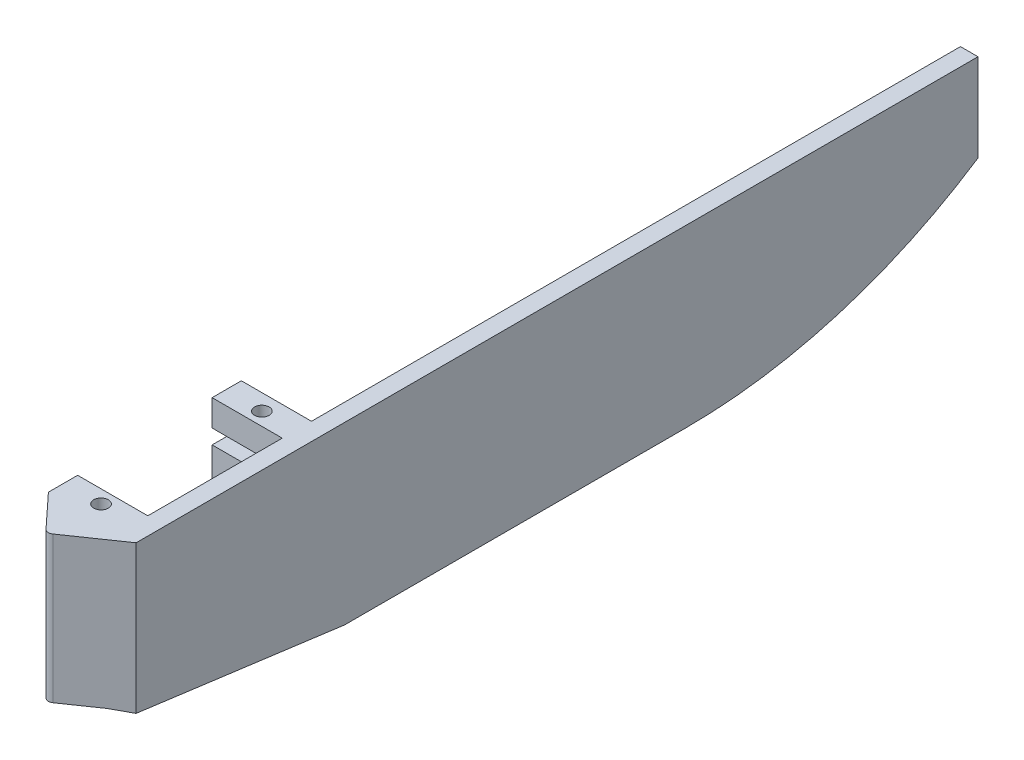
from build123d import *

# Parameters (mm, degrees)
SKETCH_1_W          = 150
SKETCH_1_H          = 30
EXTRUDE_1_DEPTH     = 3
SKETCH_2_W          = 5
SKETCH_2_H          = 4.5
SKETCH_2_H_2        = 5
EXTRUDE_2_DEPTH     = 12
SKETCH_3_R          = 1.25
CUT_EXTRUDE_1_DEPTH = 12
CUT_EXTRUDE_2_DEPTH = 33
SKETCH_6_W          = 12
SKETCH_6_H          = 5
CUT_EXTRUDE_3_DEPTH = 14
CUT_EXTRUDE_4_DEPTH = 14
CUT_EXTRUDE_5_DEPTH = 14
SKETCH_9_W          = 52.537386277
SKETCH_9_H          = 169.005460475
CUT_EXTRUDE_6_DEPTH = 39


with BuildPart() as part:
    # 草图1 → 凸台-拉伸1 (new body)
    with BuildSketch(Plane(origin=(0, 0, 0), x_dir=(0, 0, -1), z_dir=(1, 0, 0))):
        with Locations((75, 15)):
            Rectangle(SKETCH_1_W, SKETCH_1_H)
    extrude_1 = extrude(amount=EXTRUDE_1_DEPTH)

    # 草图2 → 凸台-拉伸2 (add)
    with BuildSketch(Plane(origin=(3, 0, 0), x_dir=(0, 0, -1), z_dir=(1, 0, 0))):
        Polygon((6, 30), (11, 30), (11, 25.500001474), (6.003642258, 25.500001474), (6.003642258, 23.000001474), (11.003642258, 23.000001474), (11.003642258, 18.000001474), (6.003642258, 18.000001474), (6.003642258, 0), (0, 0), (0, 30), align=None)
        with Locations((36.5, 27.75)):
            Rectangle(SKETCH_2_W, SKETCH_2_H)
        with Locations((36.503642258, 20.500001474)):
            Rectangle(SKETCH_2_W, SKETCH_2_H_2)
    extrude_2 = extrude(amount=EXTRUDE_2_DEPTH)

    # 草图3 → 切除-拉伸1 (cut)
    with BuildSketch(Plane(origin=(0, 30, 0), x_dir=(1, 0, 0), z_dir=(0, 1, 0))):
        with Locations(Location((8.75, 36.25, 0), (0, 0, 270))):
            Circle(SKETCH_3_R)
        with Locations(Location((8.75, 8.75, 0), (0, 0, 270))):
            Circle(SKETCH_3_R)
    cut_extrude_1 = extrude(amount=-CUT_EXTRUDE_1_DEPTH, mode=Mode.SUBTRACT)

    # 草图5 → 切除-拉伸2 (cut)
    with BuildSketch(Plane(origin=(0, 30, 0), x_dir=(1, 0, 0), z_dir=(0, 1, 0))):
        with BuildLine():
            Line((0, 0), (9, 0))
            ThreePointArc((9, 0), (8.702388097, 0.045313059), (8.431747605, 0.17714569))
            Line((8.431747605, 0.17714569), (0, 6))
            Line((0, 6), (0, 0))
        make_face()
        with BuildLine():
            Line((15, 0), (15, 6))
            Line((15, 6), (9.733275958, 0.32006885))
            ThreePointArc((9.733275958, 0.32006885), (9.400043029, 0.083503642), (9, 0))
            Line((9, 0), (15, 0))
        make_face()
    cut_extrude_2 = extrude(amount=-CUT_EXTRUDE_2_DEPTH, mode=Mode.SUBTRACT)

    # 草图6 → 切除-拉伸3 (cut)
    with BuildSketch(Plane(origin=(0, 0, -6.003642258), x_dir=(-1, 0, 0), z_dir=(0, 0, -1))):
        with Locations((-9, 2.5)):
            Rectangle(SKETCH_6_W, SKETCH_6_H)
    cut_extrude_3 = extrude(amount=-CUT_EXTRUDE_3_DEPTH, mode=Mode.SUBTRACT)

    # 草图7 → 切除-拉伸4 (cut)
    with BuildSketch(Plane(origin=(3, 0, 0), x_dir=(0, 0, -1), z_dir=(1, 0, 0))):
        Polygon((41.659631445, 0), (3.928239346, 0), (3.928239346, 5), align=None)
    cut_extrude_4 = extrude(amount=-CUT_EXTRUDE_4_DEPTH, mode=Mode.SUBTRACT)

    # 草图8 → 切除-拉伸5 (cut)
    with BuildSketch(Plane(origin=(3, 0, 0), x_dir=(0, 0, -1), z_dir=(1, 0, 0))):
        with BuildLine():
            Line((100, 0), (150, 0))
            Line((150, 0), (150, 15))
            ThreePointArc((150, 15), (126.100766272, 3.830779092), (100, 0))
        make_face()
    cut_extrude_5 = extrude(amount=-CUT_EXTRUDE_5_DEPTH, mode=Mode.SUBTRACT)

    # 镜向2: 凸台-拉伸1, 凸台-拉伸2, 切除-拉伸1, 切除-拉伸2, 切除-拉伸3, 切除-拉伸4, 切除-拉伸5 across plane
    add(extrude_1.mirror(Plane(origin=(0, 0, 0), x_dir=(0, 0, 1), z_dir=(1, 0, 0))))
    add(extrude_2.mirror(Plane(origin=(0, 0, 0), x_dir=(0, 0, 1), z_dir=(1, 0, 0))))
    add(cut_extrude_1.mirror(Plane(origin=(0, 0, 0), x_dir=(0, 0, 1), z_dir=(1, 0, 0))), mode=Mode.SUBTRACT)
    add(cut_extrude_2.mirror(Plane(origin=(0, 0, 0), x_dir=(0, 0, 1), z_dir=(1, 0, 0))), mode=Mode.SUBTRACT)
    add(cut_extrude_3.mirror(Plane(origin=(0, 0, 0), x_dir=(0, 0, 1), z_dir=(1, 0, 0))), mode=Mode.SUBTRACT)
    add(cut_extrude_4.mirror(Plane(origin=(0, 0, 0), x_dir=(0, 0, 1), z_dir=(1, 0, 0))), mode=Mode.SUBTRACT)
    add(cut_extrude_5.mirror(Plane(origin=(0, 0, 0), x_dir=(0, 0, 1), z_dir=(1, 0, 0))), mode=Mode.SUBTRACT)

    # 草图9 → 切除-拉伸6 (cut)
    with BuildSketch(Plane(origin=(0, 30, 0), x_dir=(1, 0, 0), z_dir=(0, 1, 0))):
        with Locations((26.268693139, 84.502730238)):
            Rectangle(SKETCH_9_W, SKETCH_9_H)
    extrude(amount=-CUT_EXTRUDE_6_DEPTH, mode=Mode.SUBTRACT)


solid = part.part
